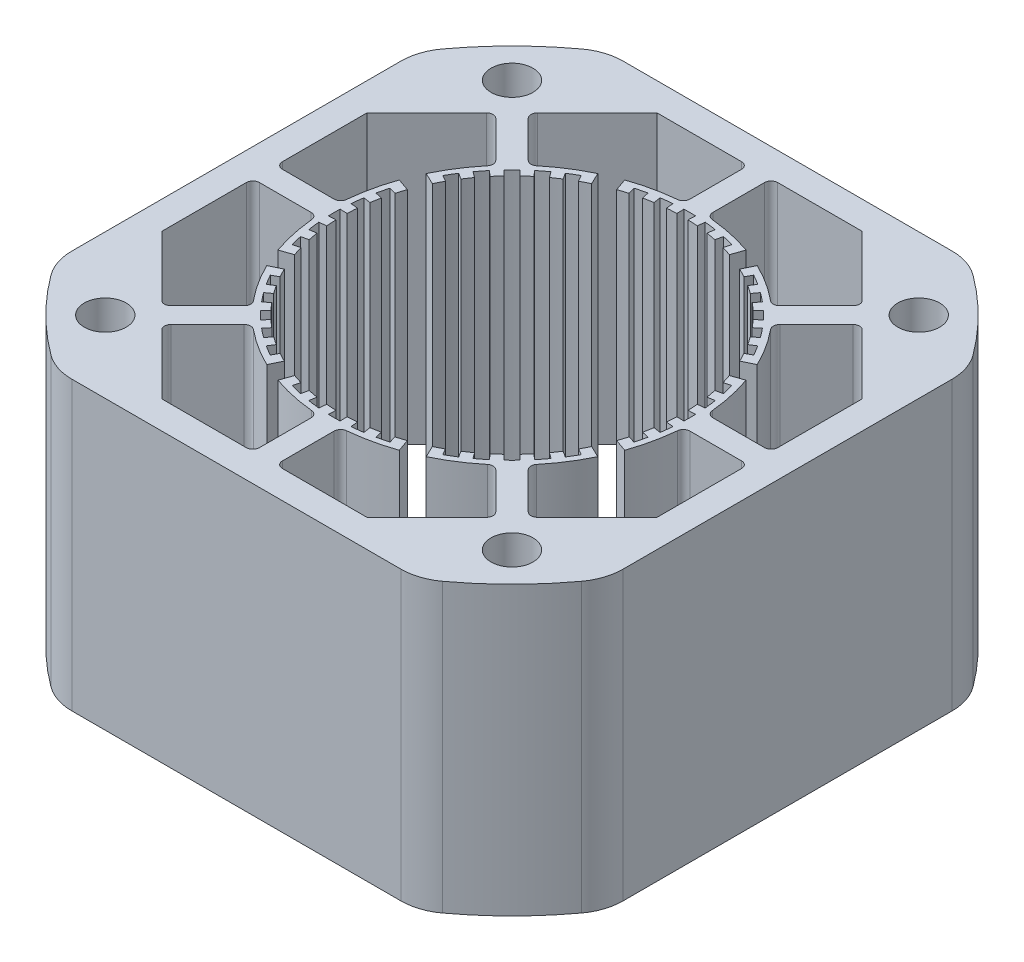
from build123d import *

# Parameters (mm, degrees)
BOSS_EXTRUDE2_DEPTH        = 21.9
BOSS_EXTRUDE3_DEPTH        = 21.9
CIRPATTERN1_COUNT          = 8
F_3_2_3_2_DIAMETER_HOLE1_D = 3.2


with BuildPart() as part:
    # Sketch10 → Boss-Extrude2 (new body)
    with BuildSketch(Plane(origin=(0, 0, 0), x_dir=(1, 0, 0), z_dir=(0, 1, 0))):
        with BuildLine():
            Line((12.540559198, 21), (-12.540559198, 21))
            ThreePointArc((-12.540559198, 21), (-13.79041126, 20.799719703), (-14.915102951, 20.218934911))
            ThreePointArc((-14.915102951, 20.218934911), (-17.766057877, 17.766057877), (-20.218934911, 14.915102951))
            ThreePointArc((-20.218934911, 14.915102951), (-20.799719703, 13.79041126), (-21, 12.540559198))
            Line((-21, 12.540559198), (-21, -12.540559198))
            ThreePointArc((-21, -12.540559198), (-20.799719703, -13.79041126), (-20.218934911, -14.915102951))
            ThreePointArc((-20.218934911, -14.915102951), (-17.766057877, -17.766057877), (-14.915102951, -20.218934911))
            ThreePointArc((-14.915102951, -20.218934911), (-13.79041126, -20.799719703), (-12.540559198, -21))
            Line((-12.540559198, -21), (12.540559198, -21))
            ThreePointArc((12.540559198, -21), (13.79041126, -20.799719703), (14.915102951, -20.218934911))
            ThreePointArc((14.915102951, -20.218934911), (17.766057877, -17.766057877), (20.218934911, -14.915102951))
            ThreePointArc((20.218934911, -14.915102951), (20.799719703, -13.79041126), (21, -12.540559198))
            Line((21, -12.540559198), (21, 12.540559198))
            ThreePointArc((21, 12.540559198), (20.799719703, 13.79041126), (20.218934911, 14.915102951))
            ThreePointArc((20.218934911, 14.915102951), (17.766057877, 17.766057877), (14.915102951, 20.218934911))
            ThreePointArc((14.915102951, 20.218934911), (13.79041126, 20.799719703), (12.540559198, 21))
        make_face()
        Polygon((7.81828099, -18.875), (18.875, -7.81828099), (18.875, 7.81828099), (7.81828099, 18.875), (-7.81828099, 18.875), (-18.875, 7.81828099), (-18.875, -7.81828099), (-7.81828099, -18.875), align=None, mode=Mode.SUBTRACT)
    extrude(amount=BOSS_EXTRUDE2_DEPTH)

    # Sketch11 → Boss-Extrude3 (add)
    with BuildSketch(Plane(origin=(0, 0, 0), x_dir=(1, 0, 0), z_dir=(0, 1, 0))):
        with BuildLine():
            Line((-0.875, 18.375), (-0.875, 14.434658811))
            ThreePointArc((-0.875, 14.434658811), (-1.005062913, 14.098286173), (-1.327586207, 13.936911955))
            ThreePointArc((-1.327586207, 13.936911955), (-2.997544584, 13.675332773), (-4.623806337, 13.214401801))
            Line((-4.623806337, 13.214401801), (-4.293534456, 12.270515958))
            ThreePointArc((-4.293534456, 12.270515958), (-3.937790567, 12.389261699), (-3.578769358, 12.497696183))
            Line((-3.578769358, 12.497696183), (-3.730178831, 13.026444868))
            ThreePointArc((-3.730178831, 13.026444868), (-3.302320369, 13.141429914), (-2.870931487, 13.242365815))
            Line((-2.870931487, 13.242365815), (-2.754399213, 12.704852812))
            ThreePointArc((-2.754399213, 12.704852812), (-2.386766867, 12.779019678), (-2.017148078, 12.842550901))
            Line((-2.017148078, 12.842550901), (-2.102488958, 13.385889592))
            ThreePointArc((-2.102488958, 13.385889592), (-1.66374948, 13.447469564), (-1.223231333, 13.494673212))
            Line((-1.223231333, 13.494673212), (-1.173579876, 12.946918949))
            ThreePointArc((-1.173579876, 12.946918949), (-0.799622691, 12.975384524), (-0.425, 12.993051027))
            Line((-0.425, 12.993051027), (-0.442980769, 13.542757032))
            ThreePointArc((-0.442980769, 13.542757032), (0, 13.55), (0.442980769, 13.542757032))
            Line((0.442980769, 13.542757032), (0.425, 12.993051027))
            ThreePointArc((0.425, 12.993051027), (0.799622691, 12.975384524), (1.173579876, 12.946918949))
            Line((1.173579876, 12.946918949), (1.223231333, 13.494673212))
            ThreePointArc((1.223231333, 13.494673212), (1.66374948, 13.447469564), (2.102488958, 13.385889592))
            Line((2.102488958, 13.385889592), (2.017148078, 12.842550901))
            ThreePointArc((2.017148078, 12.842550901), (2.386766867, 12.779019678), (2.754399213, 12.704852812))
            Line((2.754399213, 12.704852812), (2.870931487, 13.242365815))
            ThreePointArc((2.870931487, 13.242365815), (3.302320369, 13.141429914), (3.730178831, 13.026444868))
            Line((3.730178831, 13.026444868), (3.578769358, 12.497696183))
            ThreePointArc((3.578769358, 12.497696183), (3.937790567, 12.389261699), (4.293534456, 12.270515958))
            Line((4.293534456, 12.270515958), (4.623806337, 13.214401801))
            ThreePointArc((4.623806337, 13.214401801), (2.997544584, 13.675332773), (1.327586207, 13.936911955))
            ThreePointArc((1.327586207, 13.936911955), (1.005062913, 14.098286173), (0.875, 14.434658811))
            Line((0.875, 14.434658811), (0.875, 18.375))
            ThreePointArc((0.875, 18.375), (1.021446609, 18.728553391), (1.375, 18.875))
            Line((1.375, 18.875), (-1.375, 18.875))
            ThreePointArc((-1.375, 18.875), (-1.021446609, 18.728553391), (-0.875, 18.375))
        make_face()
    boss_extrude3 = extrude(amount=BOSS_EXTRUDE3_DEPTH)

    # CirPattern1: Boss-Extrude3 ×8 about axis
    cirpattern1_axis = Axis((0, 0, 0), (0, 1, 0))
    for i in range(1, CIRPATTERN1_COUNT):
        add(boss_extrude3.rotate(cirpattern1_axis, i * 360 / CIRPATTERN1_COUNT))

    # Ø3.2 (3.2) Diameter Hole1 (through all)
    with Locations(Plane(origin=(0, 21.9, 0), x_dir=(-1, 0, 0), z_dir=(0, 1, 0))):
        with Locations((-15.5, 15.5), (-15.5, -15.5), (15.5, -15.5), (15.5, 15.5)):
            Hole(F_3_2_3_2_DIAMETER_HOLE1_D / 2)


solid = part.part
